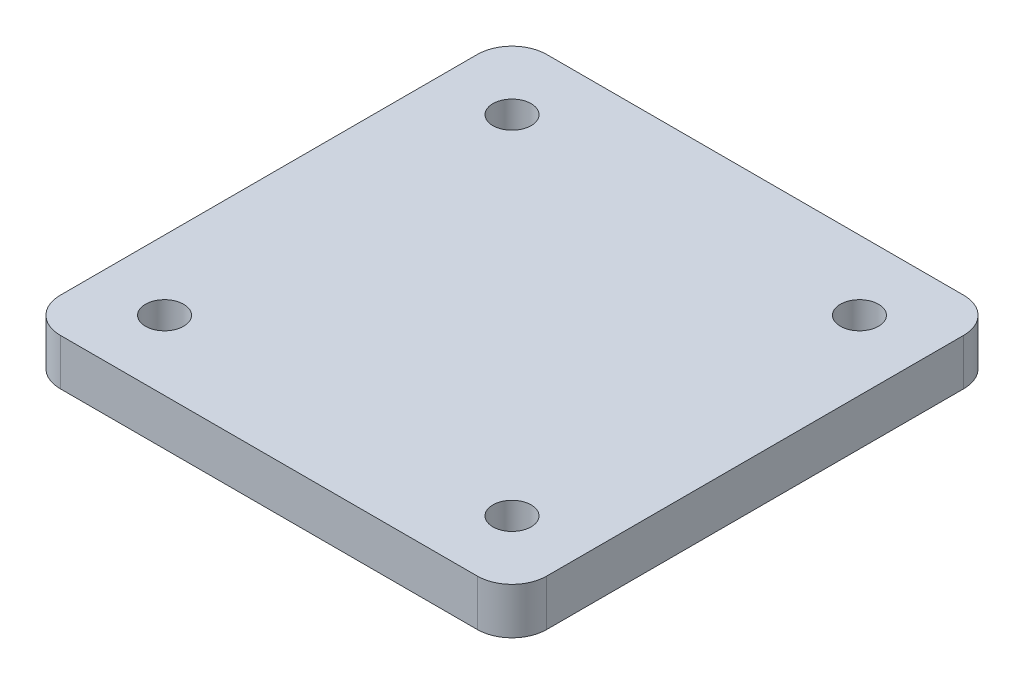
from build123d import *

# Parameters (mm, degrees)
SKETCH_1_W          = 42
SKETCH_1_H          = 4
BLOCKEXTRUDE_DEPTH  = 42
FILLET_2_R          = 3
SKETCH_2_R          = 1.65
MOUNT_HOLE_DEPTH    = 60.531504265
SKETCH_3_R          = 1.65
CUT_EXTRUDE_2_DEPTH = 60.531504265
SKETCH_4_R          = 1.65
CUT_EXTRUDE_3_DEPTH = 60.531504265
SKETCH_5_R          = 1.65
CUT_EXTRUDE_4_DEPTH = 60.531504265


with BuildPart() as part:
    # 草图1 → BlockExtrude (new body)
    with BuildSketch(Plane.XY):
        with Locations((21, 2)):
            Rectangle(SKETCH_1_W, SKETCH_1_H)
    extrude(amount=BLOCKEXTRUDE_DEPTH)

    # Fillet 2
    fillet_2_edges = [part.edges().sort_by_distance(p)[0] for p in [
        (42, 2, 42),
        (0, 2, 42),
        (42, 2, 0),
        (0, 2, 0),
    ]]
    fillet(fillet_2_edges, radius=FILLET_2_R)

    # 草图2 → Mount_hole (cut, through all)
    with BuildSketch(Plane(origin=(0, 4, 0), x_dir=(1, 0, 0), z_dir=(0, 1, 0))):
        with Locations(Location((6, -6, 0), (0, 0, 270))):
            Circle(SKETCH_2_R)
    extrude(amount=-MOUNT_HOLE_DEPTH, mode=Mode.SUBTRACT)

    # 草图3 → 切除-拉伸2 (cut, through all)
    with BuildSketch(Plane(origin=(0, 4, 0), x_dir=(1, 0, 0), z_dir=(0, 1, 0))):
        with Locations(Location((6, -36, 0), (0, 0, 270))):
            Circle(SKETCH_3_R)
    extrude(amount=-CUT_EXTRUDE_2_DEPTH, mode=Mode.SUBTRACT)

    # 草图4 → 切除-拉伸3 (cut, through all)
    with BuildSketch(Plane(origin=(0, 4, 0), x_dir=(1, 0, 0), z_dir=(0, 1, 0))):
        with Locations(Location((36, -6, 0), (0, 0, 270))):
            Circle(SKETCH_4_R)
    extrude(amount=-CUT_EXTRUDE_3_DEPTH, mode=Mode.SUBTRACT)

    # 草图5 → 切除-拉伸4 (cut, through all)
    with BuildSketch(Plane(origin=(0, 4, 0), x_dir=(1, 0, 0), z_dir=(0, 1, 0))):
        with Locations(Location((36, -36, 0), (0, 0, 270))):
            Circle(SKETCH_5_R)
    extrude(amount=-CUT_EXTRUDE_4_DEPTH, mode=Mode.SUBTRACT)


solid = part.part
